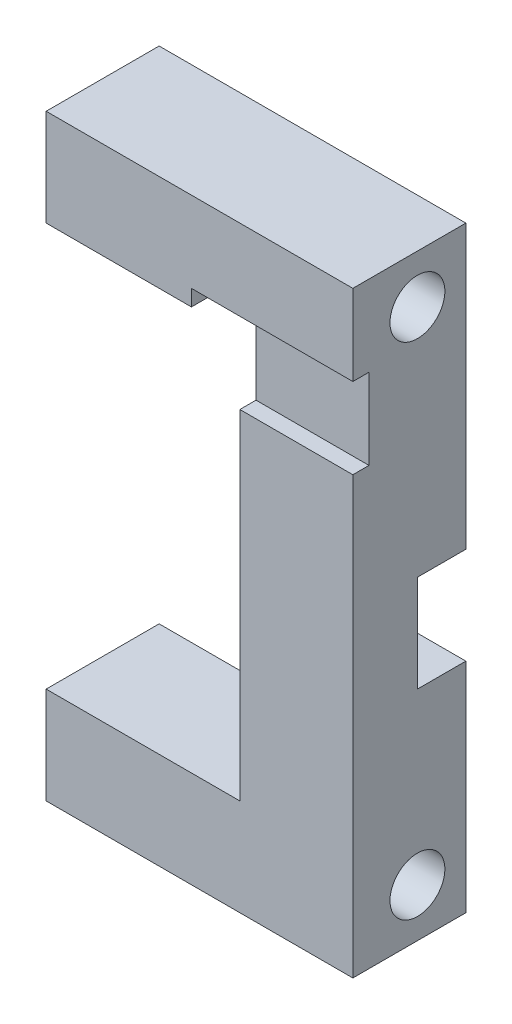
from build123d import *

# Parameters (mm, degrees)
EXTRUDE_1_DEPTH     = 7
SKETCH_2_W          = 7
SKETCH_2_H          = 6
CUT_EXTRUDE_1_DEPTH = 3
SKETCH_3_R          = 1.7
CUT_EXTRUDE_2_DEPTH = 43.178193418
SKETCH_4_W          = 10
SKETCH_4_H          = 5
CUT_EXTRUDE_3_DEPTH = 1


with BuildPart() as part:
    # 草图1 → 凸台-拉伸1 (new body)
    with BuildSketch(Plane.XY):
        Polygon((0, 0), (0, 6), (12, 6), (12, 11), (12, 26), (12, 31), (0, 31), (0, 37), (19, 37), (19, 0), align=None)
    extrude(amount=EXTRUDE_1_DEPTH)

    # 草图2 → 切除-拉伸1 (cut)
    with BuildSketch(Plane(origin=(0, 0, 0), x_dir=(-1, 0, 0), z_dir=(0, 0, -1))):
        with Locations((-15.5, 16.5)):
            Rectangle(SKETCH_2_W, SKETCH_2_H)
    extrude(amount=-CUT_EXTRUDE_1_DEPTH, mode=Mode.SUBTRACT)

    # 草图3 → 切除-拉伸2 (cut, through all)
    with BuildSketch(Plane.ZY):
        with Locations((3, 34)):
            Circle(SKETCH_3_R)
        with Locations((3, 3)):
            Circle(SKETCH_3_R)
    extrude(amount=-CUT_EXTRUDE_2_DEPTH, mode=Mode.SUBTRACT)

    # 草图4 → 切除-拉伸3 (cut)
    with BuildSketch(Plane.XY.offset(7)):
        with Locations((14, 29.5)):
            Rectangle(SKETCH_4_W, SKETCH_4_H)
    extrude(amount=-CUT_EXTRUDE_3_DEPTH, mode=Mode.SUBTRACT)


solid = part.part
